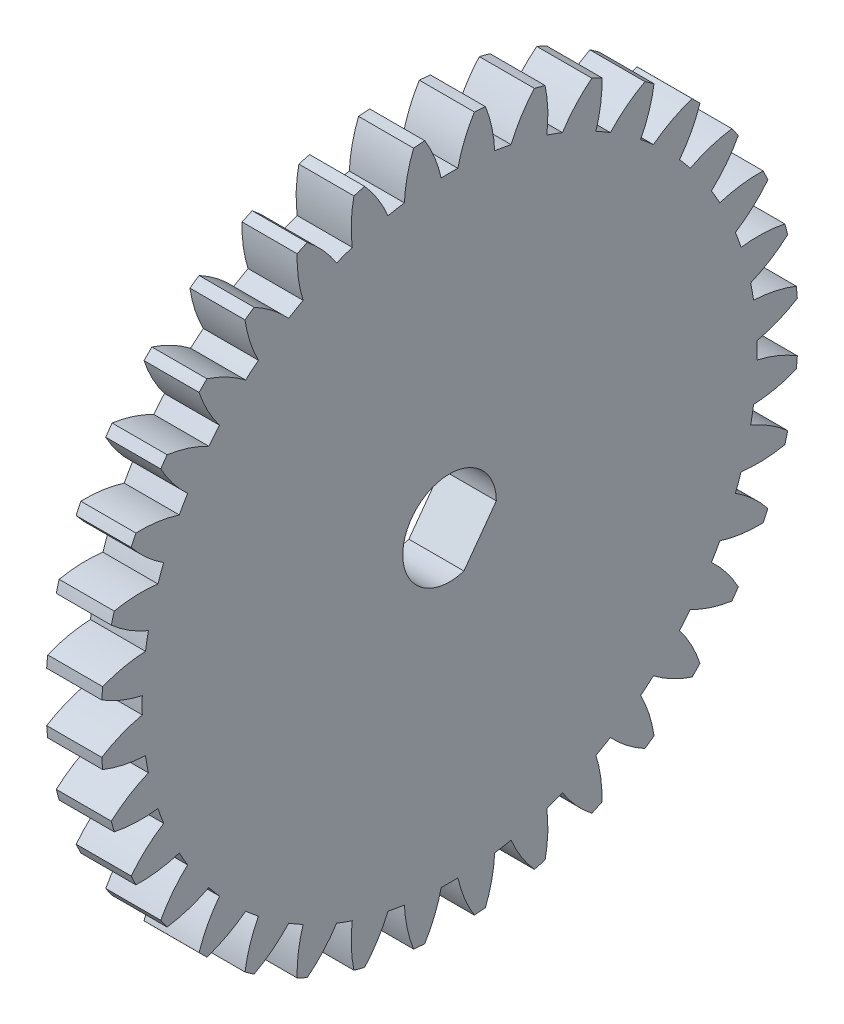
from build123d import *

# Parameters (mm, degrees)
BASPROSKE_W        = 3
BASPROSKE_H        = 19
TOOTHCUT_DEPTH     = 28.037011669
TEETHCUTS_COUNT    = 36
TEETHCUTS_ANGLE    = 350
BORSKE_R           = 0.4
BORE_DEPTH         = 50.0000508
CUT_EXTRUDE2_DEPTH = 27.969139367


with BuildPart() as part:
    # BasProSke → Base-Revolve (revolve)
    with BuildSketch(Plane(origin=(0, 0, 0), x_dir=(1, 0, 0), z_dir=(0, 1, 0)), mode=Mode.PRIVATE) as base_revolve_sk:
        with Locations((1.5, 9.5)):
            Rectangle(BASPROSKE_W, BASPROSKE_H)
    revolve(base_revolve_sk.sketch.rotate(Axis((-10, 0, 0), (1, 0, 0)), 180), axis=Axis((-10, 0, 0), (1, 0, 0)))

    # TooCutSke → ToothCut (cut, through all)
    with BuildSketch(Plane(origin=(0, 0, 0), x_dir=(0, 0, -1), z_dir=(1, 0, 0))):
        with BuildLine():
            ThreePointArc((0.454664826, 16.742827745), (0, 16.749), (-0.454664826, 16.742827745))
            ThreePointArc((-0.454664826, 16.742827745), (-0.817558311, 17.898033097), (-1.368909141, 18.976088452))
            ThreePointArc((-1.368909141, 18.976088452), (0, 19.0254), (1.368909141, 18.976088452))
            ThreePointArc((1.368909141, 18.976088452), (0.817558311, 17.898033097), (0.454664826, 16.742827745))
        make_face()
    toothcut = extrude(amount=TOOTHCUT_DEPTH, mode=Mode.SUBTRACT)

    # TeethCuts: ToothCut ×36 about axis
    teethcuts_axis = Axis((-10, 0, 0), (1, 0, 0))
    for i in range(1, TEETHCUTS_COUNT):
        add(toothcut.rotate(teethcuts_axis, i * TEETHCUTS_ANGLE / (TEETHCUTS_COUNT - 1)), mode=Mode.SUBTRACT)

    # BorSke → Bore (cut, symmetric)
    with BuildSketch(Plane(origin=(0, 0, 0), x_dir=(0, 0, -1), z_dir=(1, 0, 0))):
        with Locations(Location((0, 0, 0), (0, 0, 180))):
            Circle(BORSKE_R)
    extrude(amount=BORE_DEPTH, both=True, mode=Mode.SUBTRACT)

    # Sketch2 → Cut-Extrude2 (cut, through all)
    with BuildSketch(Plane.ZY):
        with BuildLine():
            Line((-2.55, 0), (-0.785294118, -2.426069486))
            ThreePointArc((-0.785294118, -2.426069486), (2.062159063, 1.5), (-2.55, 0))
        make_face()
    extrude(amount=-CUT_EXTRUDE2_DEPTH, mode=Mode.SUBTRACT)


solid = part.part
